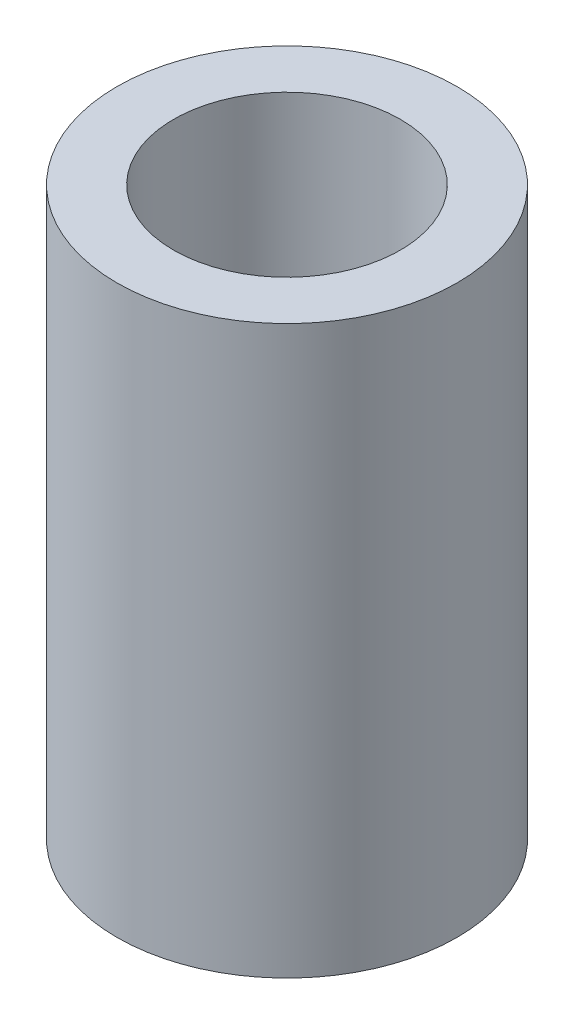
from build123d import *

# Parameters (mm, degrees)
SKETCH1_R           = 6
SKETCH1_R_2         = 4
BOSS_EXTRUDE1_DEPTH = 20


with BuildPart() as part:
    # Sketch1 → Boss-Extrude1 (new body)
    with BuildSketch(Plane(origin=(0, 0, 0), x_dir=(1, 0, 0), z_dir=(0, 1, 0))):
        with Locations(Location((0, 0, 0), (0, 0, 270))):
            Circle(SKETCH1_R)
        with Locations(Location((0, 0, 0), (0, 0, 270))):
            Circle(SKETCH1_R_2, mode=Mode.SUBTRACT)
    extrude(amount=BOSS_EXTRUDE1_DEPTH)


solid = part.part
